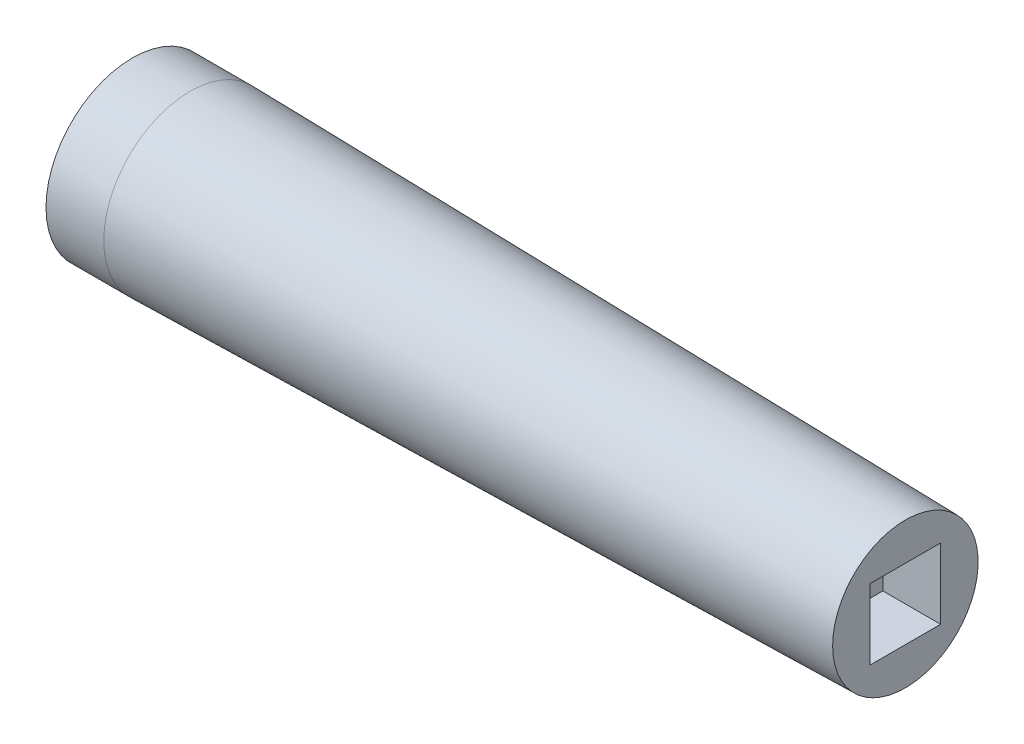
from build123d import *

# Parameters (mm, degrees)
CUT_EXTRUDE1_DEPTH      = 173.110429667
CUT_EXTRUDE1_DEPTH_BACK = 12.7
SKETCH2_W               = 15.5
SKETCH2_H               = 15.5


with BuildPart() as part:
    # Sketch1 → Revolve1 (revolve)
    with BuildSketch(Plane.XY, mode=Mode.PRIVATE) as revolve1_sk:
        Polygon((0, 0), (170, 0), (170, 16), (12.7, 19), (0, 19), align=None)
    revolve(revolve1_sk.sketch.rotate(Axis((0, 0, 0), (1, 0, 0)), 90), axis=Axis((0, 0, 0), (1, 0, 0)))

    # Sketch2 → Cut-Extrude1 (cut, two sides: drawn at the far end of the back side and taken through both)
    with BuildSketch(Plane(origin=(170, 0, 0), x_dir=(0, 0, -1), z_dir=(1, 0, 0)).offset(-CUT_EXTRUDE1_DEPTH_BACK)):
        Rectangle(SKETCH2_W, SKETCH2_H)
    extrude(amount=CUT_EXTRUDE1_DEPTH + CUT_EXTRUDE1_DEPTH_BACK, mode=Mode.SUBTRACT)


solid = part.part
